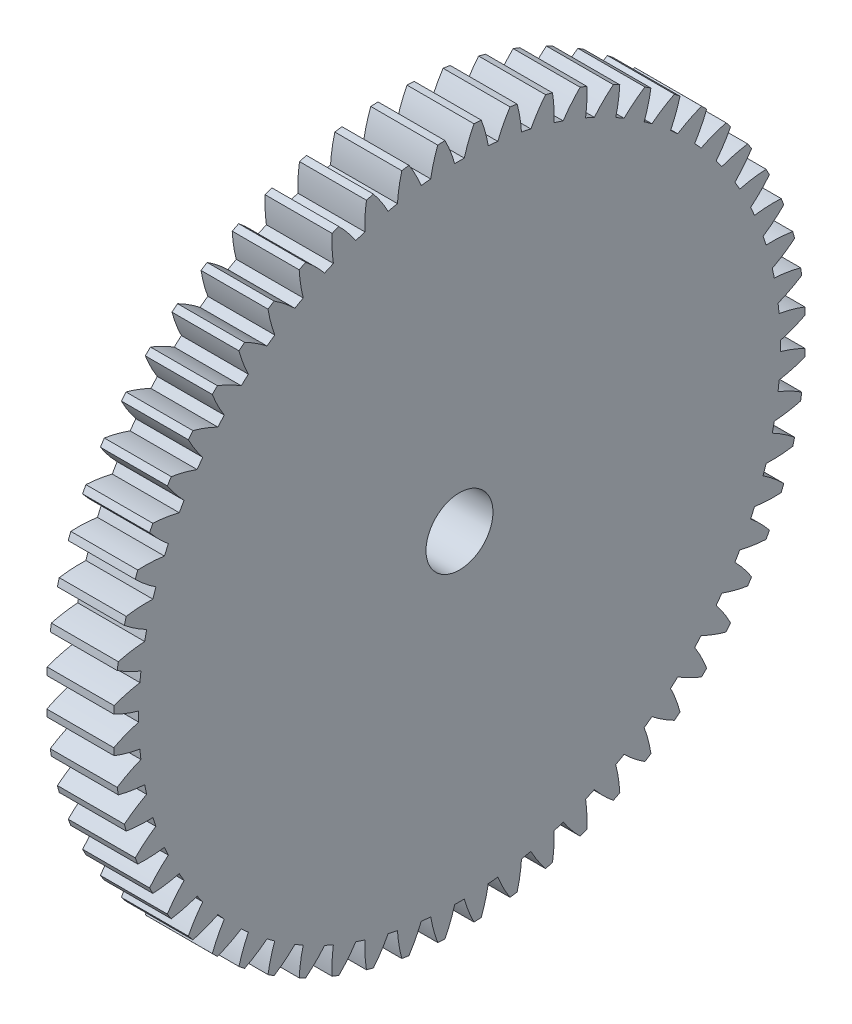
from build123d import *

# Parameters (mm, degrees)
BASPROSKE_W     = 3
BASPROSKE_H     = 15.5
TOOTHCUT_DEPTH  = 23.12464689
TEETHCUTS_COUNT = 60
TEETHCUTS_ANGLE = 354
BORSKE_R        = 1.5
BORE_DEPTH      = 50.0000508


with BuildPart() as part:
    # BasProSke → Base-Revolve (revolve)
    with BuildSketch(Plane(origin=(0, 0, 0), x_dir=(1, 0, 0), z_dir=(0, 1, 0)), mode=Mode.PRIVATE) as base_revolve_sk:
        with Locations((1.5, 7.75)):
            Rectangle(BASPROSKE_W, BASPROSKE_H)
    revolve(base_revolve_sk.sketch.rotate(Axis((-10, 0, 0), (1, 0, 0)), 180), axis=Axis((-10, 0, 0), (1, 0, 0)))

    # TooCutSke → ToothCut (cut, through all)
    with BuildSketch(Plane(origin=(0, 0, 0), x_dir=(0, 0, -1), z_dir=(1, 0, 0))):
        with BuildLine():
            ThreePointArc((0.21493681, 14.372392917), (0, 14.374), (-0.21493681, 14.372392917))
            ThreePointArc((-0.21493681, 14.372392917), (-0.409732631, 14.953266942), (-0.662749221, 15.51124781))
            ThreePointArc((-0.662749221, 15.51124781), (0, 15.5254), (0.662749221, 15.51124781))
            ThreePointArc((0.662749221, 15.51124781), (0.409732631, 14.953266942), (0.21493681, 14.372392917))
        make_face()
    toothcut = extrude(amount=TOOTHCUT_DEPTH, mode=Mode.SUBTRACT)

    # TeethCuts: ToothCut ×60 about axis
    teethcuts_axis = Axis((-10, 0, 0), (1, 0, 0))
    for i in range(1, TEETHCUTS_COUNT):
        add(toothcut.rotate(teethcuts_axis, i * TEETHCUTS_ANGLE / (TEETHCUTS_COUNT - 1)), mode=Mode.SUBTRACT)

    # BorSke → Bore (cut, symmetric)
    with BuildSketch(Plane(origin=(0, 0, 0), x_dir=(0, 0, -1), z_dir=(1, 0, 0))):
        with Locations(Location((0, 0, 0), (0, 0, 180))):
            Circle(BORSKE_R)
    extrude(amount=BORE_DEPTH, both=True, mode=Mode.SUBTRACT)


solid = part.part
